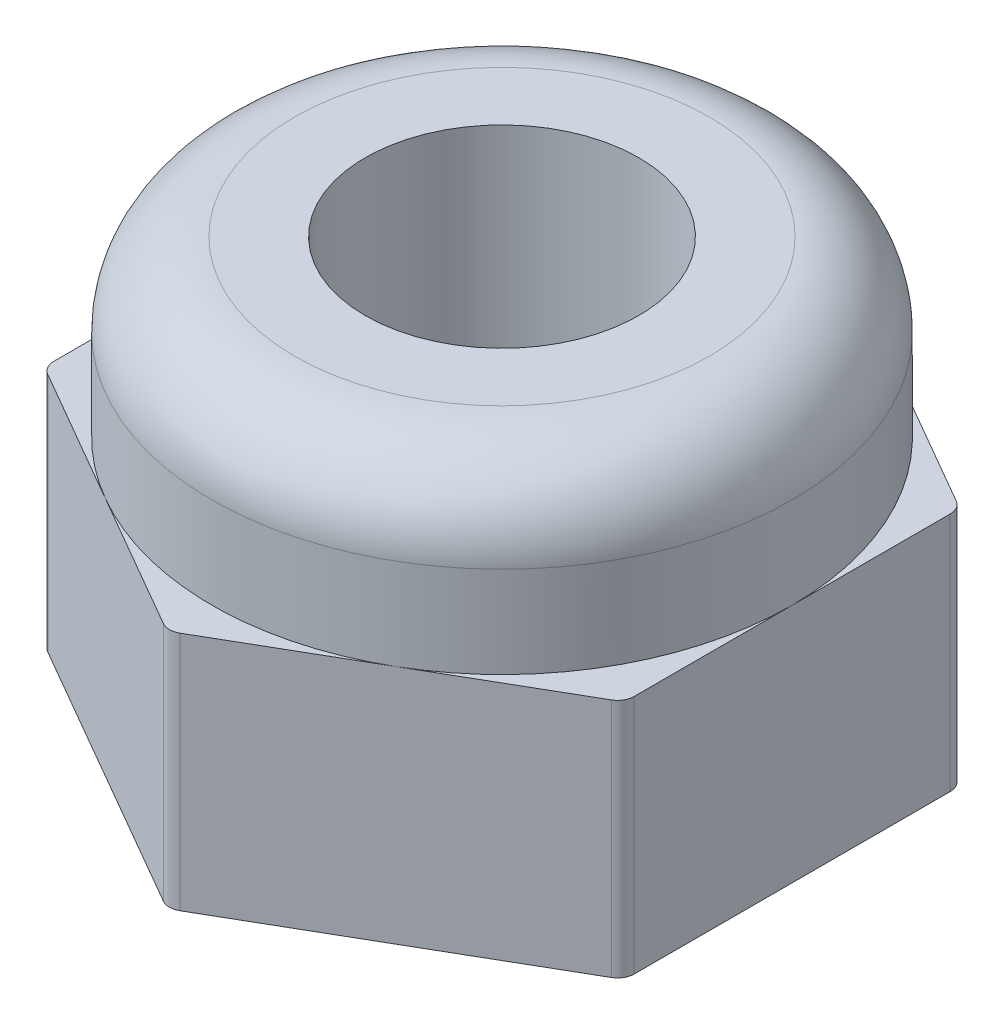
from build123d import *

# Parameters (mm, degrees)
EXTRUDE_1_DEPTH        = 2.9
SKETCH_2_R             = 3.5
EXTRUDE_2_DEPTH        = 5
FILLET_1_R             = 1
FILLET_2_R             = 0.2
HOLE_WIZARD_M4_1_D     = 3.3
HOLE_WIZARD_M4_1_DEPTH = 10.1
HOLE_WIZARD_M4_1_TIP   = 0.991420021


with BuildPart() as part:
    # 草图1 → 凸台-拉伸1 (new body)
    with BuildSketch(Plane(origin=(0, 0, 0), x_dir=(1, 0, 0), z_dir=(0, 1, 0))):
        Polygon((3.5, 2.020725942), (0, 4.041451884), (-3.5, 2.020725942), (-3.5, -2.020725942), (0, -4.041451884), (3.5, -2.020725942), align=None)
    extrude(amount=EXTRUDE_1_DEPTH)

    # 草图2 → 凸台-拉伸2 (add)
    with BuildSketch(Plane.XZ):
        with Locations(Location((0, 0, 0), (0, 0, 270))):
            Circle(SKETCH_2_R)
    extrude(amount=-EXTRUDE_2_DEPTH)

    # 圆角1
    fillet_1_edges = [part.edges().sort_by_distance(p)[0] for p in [
        (0, 5, 3.5),
    ]]
    fillet(fillet_1_edges, radius=FILLET_1_R)

    # 圆角2
    fillet_2_edges = [part.edges().sort_by_distance(p)[0] for p in [
        (3.5, 1.45, 2.020725942),
        (0, 1.45, 4.041451884),
        (-3.5, 1.45, 2.020725942),
        (-3.5, 1.45, -2.020725942),
        (0, 1.45, -4.041451884),
        (3.5, 1.45, -2.020725942),
    ]]
    fillet(fillet_2_edges, radius=FILLET_2_R)

    # M4 螺纹孔1
    with Locations(Plane(origin=(0, 0, 0), x_dir=(-1, 0, 0), z_dir=(0, -1, 0))):
        with Locations((0, 0)):
            Hole(HOLE_WIZARD_M4_1_D / 2, depth=HOLE_WIZARD_M4_1_DEPTH)
            with Locations((0, 0, -(HOLE_WIZARD_M4_1_DEPTH + HOLE_WIZARD_M4_1_TIP / 2))):  # 118° drill point
                Cone(0, HOLE_WIZARD_M4_1_D / 2, HOLE_WIZARD_M4_1_TIP, mode=Mode.SUBTRACT)


solid = part.part
